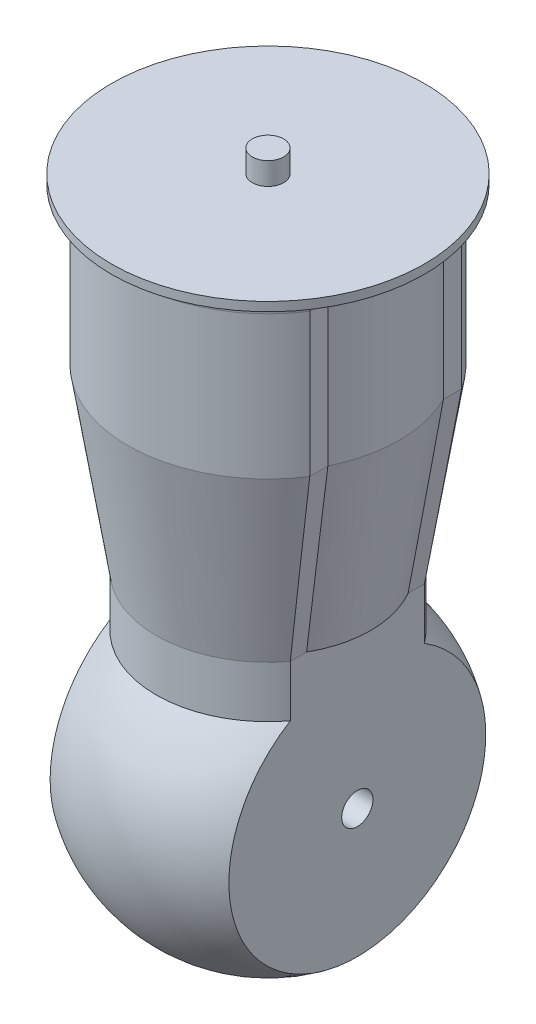
from build123d import *
from build123d.topology import SkipClean

# Parameters (mm, degrees)
CUT_EXTRUDE1_DEPTH      = 35
CUT_EXTRUDE1_DEPTH_BACK = 35
SKETCH2_OUTSIDE_W       = 96.248
SKETCH2_OUTSIDE_H       = 96.248
BOSS_EXTRUDE1_DEPTH     = 36
SKETCH4_R               = 3.5
CUT_EXTRUDE2_DEPTH      = 5
LPATTERN1_COUNT         = 2
LPATTERN1_PITCH         = 35
BOSS_EXTRUDE2_DEPTH     = 40
BOSS_EXTRUDE2_DRAFT     = -9
BOSS_EXTRUDE6_DEPTH     = 35
SKETCH10_R              = 35
BOSS_EXTRUDE7_DEPTH     = 2
FILLET5_R               = 3
SKETCH11_R              = 3.5
BOSS_EXTRUDE8_DEPTH     = 5


with BuildPart() as part:
    # Sketch1 → Revolve2 (revolve)
    with BuildSketch(Plane(origin=(0, 0, 0), x_dir=(1, 0, 0), z_dir=(0, 1, 0))):
        with BuildLine():
            Line((0, 35), (0, -35))
            ThreePointArc((0, -35), (35, 0), (0, 35))
        make_face()
    revolve(axis=Axis((0, 0, -35), (0, 0, 1)))

    # Sketch2 outside → Cut-Extrude1 (cut, two sides: drawn at the far end of the back side and taken through both)
    with SkipClean():  # the faces are left unmerged after this step: merging them gives an invalid solid
        with BuildSketch(Plane(origin=(0, 0, 0), x_dir=(1, 0, 0), z_dir=(0, 1, 0)).offset(-CUT_EXTRUDE1_DEPTH_BACK)):
            Rectangle(SKETCH2_OUTSIDE_W, SKETCH2_OUTSIDE_H)
            with BuildLine():
                Line((-20, -28.722813233), (-20, 28.722813233))
                ThreePointArc((-20, 28.722813233), (0, 35), (20, 28.722813233))
                Line((20, 28.722813233), (20, -28.722813233))
                ThreePointArc((20, -28.722813233), (0, -35), (-20, -28.722813233))
            make_face(mode=Mode.SUBTRACT)
        extrude(amount=CUT_EXTRUDE1_DEPTH + CUT_EXTRUDE1_DEPTH_BACK, mode=Mode.SUBTRACT)

    # Sketch3 → Boss-Extrude1 (add)
    with BuildSketch(Plane(origin=(0, 0, 0), x_dir=(1, 0, 0), z_dir=(0, 1, 0))):
        with BuildLine():
            Line((-20, 15), (-20, -15))
            ThreePointArc((-20, -15), (0, -25), (20, -15))
            Line((20, -15), (20, 15))
            ThreePointArc((20, 15), (0, 25), (-20, 15))
        make_face()
    extrude(amount=BOSS_EXTRUDE1_DEPTH)

    # Sketch4 → Cut-Extrude2 (cut)
    with BuildSketch(Plane.ZY.offset(20)):
        Circle(SKETCH4_R)
    cut_extrude2 = extrude(amount=-CUT_EXTRUDE2_DEPTH, mode=Mode.SUBTRACT)

    # LPattern1: Cut-Extrude2 ×2
    with Locations(*[(i * LPATTERN1_PITCH, 0, 0) for i in range(1, LPATTERN1_COUNT)]):
        add(cut_extrude2, mode=Mode.SUBTRACT)


with BuildPart() as boss_extrude2_tool:
    # Sketch5 → Boss-Extrude2 (with draft: the straight prism first)
    with BuildSketch(Plane(origin=(0, 36, 0), x_dir=(1, 0, 0), z_dir=(0, 1, 0))):
        with BuildLine():
            Line((-20, 15), (-20, 11.357816692))
            ThreePointArc((-20, 11.357816692), (-23, 0), (-20, -11.357816692))
            Line((-20, -11.357816692), (-20, -15))
            ThreePointArc((-20, -15), (0, -25), (20, -15))
            Line((20, -15), (20, -11.357816692))
            ThreePointArc((20, -11.357816692), (23, 0), (20, 11.357816692))
            Line((20, 11.357816692), (20, 15))
            ThreePointArc((20, 15), (0, 25), (-20, 15))
        make_face()
    extrude(amount=BOSS_EXTRUDE2_DEPTH)
    # Boss-Extrude2: the draft: its side faces are tilted about the plane it starts from
    boss_extrude2_sides = [boss_extrude2_tool.faces().sort_by_distance(p)[0] for p in [
        (20, 56, -13.178908346),
        (0, 56, -25),
        (-20, 56, -13.178908346),
        (-23, 56, 0),
        (-20, 56, 13.178908346),
        (0, 56, 25),
        (20, 56, 13.178908346),
        (23, 56, 0),
    ]]
    draft(boss_extrude2_sides, Plane(origin=(0, 36, 0), x_dir=(1, 0, 0), z_dir=(0, 1, 0)), BOSS_EXTRUDE2_DRAFT)


with BuildPart() as part_1:
    add(part.part)

    # Boss-Extrude2: add boss_extrude2_tool
    add(boss_extrude2_tool.part)

    # Sketch9 → Boss-Extrude6 (add)
    with BuildSketch(Plane(origin=(0, 76, 0), x_dir=(1, 0, 0), z_dir=(0, 1, 0))):
        with BuildLine():
            Line((26.335377613, 12.923322548), (26.335377613, 16.980982779))
            ThreePointArc((26.335377613, 16.980982779), (0, 31.335377613), (-26.335377613, 16.980982779))
            Line((-26.335377613, 16.980982779), (-26.335377613, 12.923322548))
            ThreePointArc((-26.335377613, 12.923322548), (-29.335377613, 0), (-26.335377613, -12.923322548))
            Line((-26.335377613, -12.923322548), (-26.335377613, -16.980982779))
            ThreePointArc((-26.335377613, -16.980982779), (0, -31.335377613), (26.335377613, -16.980982779))
            Line((26.335377613, -16.980982779), (26.335377613, -12.923322548))
            ThreePointArc((26.335377613, -12.923322548), (29.335377613, 0), (26.335377613, 12.923322548))
        make_face()
    extrude(amount=BOSS_EXTRUDE6_DEPTH)

    # Sketch10 → Boss-Extrude7 (add)
    with BuildSketch(Plane(origin=(0, 111, 0), x_dir=(1, 0, 0), z_dir=(0, 1, 0))):
        with Locations(Location((0, 0, 0), (0, 0, 270))):
            Circle(SKETCH10_R)
    extrude(amount=BOSS_EXTRUDE7_DEPTH)

    # Fillet5
    fillet5_edges = [part_1.edges().sort_by_distance(p)[0] for p in [
        (29.335377613, 111, 0),
        (26.335377613, 111, -14.952152663),
        (0, 111, -31.335377613),
        (-26.335377613, 111, -14.952152663),
        (-29.335377613, 111, 0),
        (-26.335377613, 111, 14.952152663),
        (0, 111, 31.335377613),
        (26.335377613, 111, 14.952152663),
    ]]
    fillet(fillet5_edges, radius=FILLET5_R)

    # Sketch11 → Boss-Extrude8 (add)
    with BuildSketch(Plane(origin=(0, 113, 0), x_dir=(1, 0, 0), z_dir=(0, 1, 0))):
        with Locations(Location((0, 0, 0), (0, 0, 270))):
            Circle(SKETCH11_R)
    extrude(amount=BOSS_EXTRUDE8_DEPTH)


solid = part_1.part
